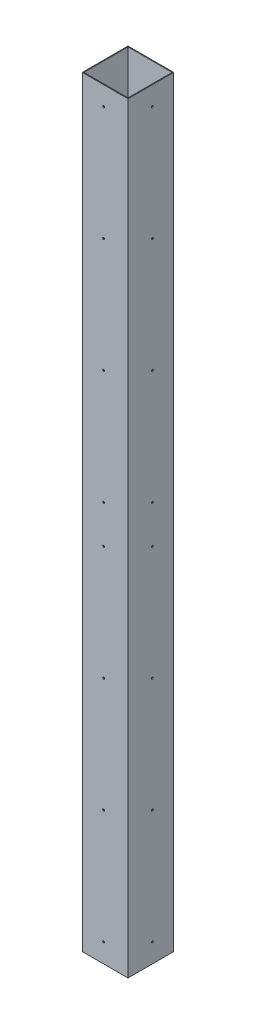
from build123d import *

# Parameters (mm, degrees)
SKETCH_1_W          = 120
SKETCH_1_H          = 120
SKETCH_1_W_2        = 116
SKETCH_1_H_2        = 116
EXTRUDE_1_DEPTH     = 2000
SKETCH_2_R          = 2.5
CUT_EXTRUDE_1_DEPTH = 2002.799190728
SKETCH_3_R          = 2.5
CUT_EXTRUDE_2_DEPTH = 2002.799190728


with BuildPart() as part:
    # 草图1 → 拉伸-薄壁1 (new body)
    with BuildSketch(Plane(origin=(0, 0, 0), x_dir=(1, 0, 0), z_dir=(0, 1, 0))):
        Rectangle(SKETCH_1_W, SKETCH_1_H)
        Rectangle(SKETCH_1_W_2, SKETCH_1_H_2, mode=Mode.SUBTRACT)
    extrude(amount=EXTRUDE_1_DEPTH)

    # 草图2 → 切除-拉伸1 (cut, through all)
    with BuildSketch(Plane(origin=(0, 0, 0), x_dir=(0, 0, -1), z_dir=(1, 0, 0))):
        with Locations(Location((4, 50, 0), (0, 0, 180))):
            Circle(SKETCH_2_R)
        with Locations(Location((4, 350, 0), (0, 0, 180))):
            Circle(SKETCH_2_R)
        with Locations(Location((4, 650, 0), (0, 0, 180))):
            Circle(SKETCH_2_R)
        with Locations(Location((4, 950, 0), (0, 0, 180))):
            Circle(SKETCH_2_R)
        with Locations(Location((4, 1950, 0), (0, 0, 180))):
            Circle(SKETCH_2_R)
        with Locations(Location((4, 1650, 0), (0, 0, 180))):
            Circle(SKETCH_2_R)
        with Locations(Location((4, 1350, 0), (0, 0, 180))):
            Circle(SKETCH_2_R)
        with Locations(Location((4, 1050, 0), (0, 0, 180))):
            Circle(SKETCH_2_R)
    extrude(amount=CUT_EXTRUDE_1_DEPTH, mode=Mode.SUBTRACT)

    # 草图3 → 切除-拉伸2 (cut, through all)
    with BuildSketch(Plane.XY):
        with Locations(Location((-4, 50, 0), (0, 0, 180))):
            Circle(SKETCH_3_R)
        with Locations(Location((-4, 350, 0), (0, 0, 180))):
            Circle(SKETCH_3_R)
        with Locations(Location((-4, 650, 0), (0, 0, 180))):
            Circle(SKETCH_3_R)
        with Locations(Location((-4, 950, 0), (0, 0, 180))):
            Circle(SKETCH_3_R)
        with Locations(Location((-4, 1950, 0), (0, 0, 180))):
            Circle(SKETCH_3_R)
        with Locations(Location((-4, 1650, 0), (0, 0, 180))):
            Circle(SKETCH_3_R)
        with Locations(Location((-4, 1350, 0), (0, 0, 180))):
            Circle(SKETCH_3_R)
        with Locations(Location((-4, 1050, 0), (0, 0, 180))):
            Circle(SKETCH_3_R)
    extrude(amount=CUT_EXTRUDE_2_DEPTH, mode=Mode.SUBTRACT)


solid = part.part
